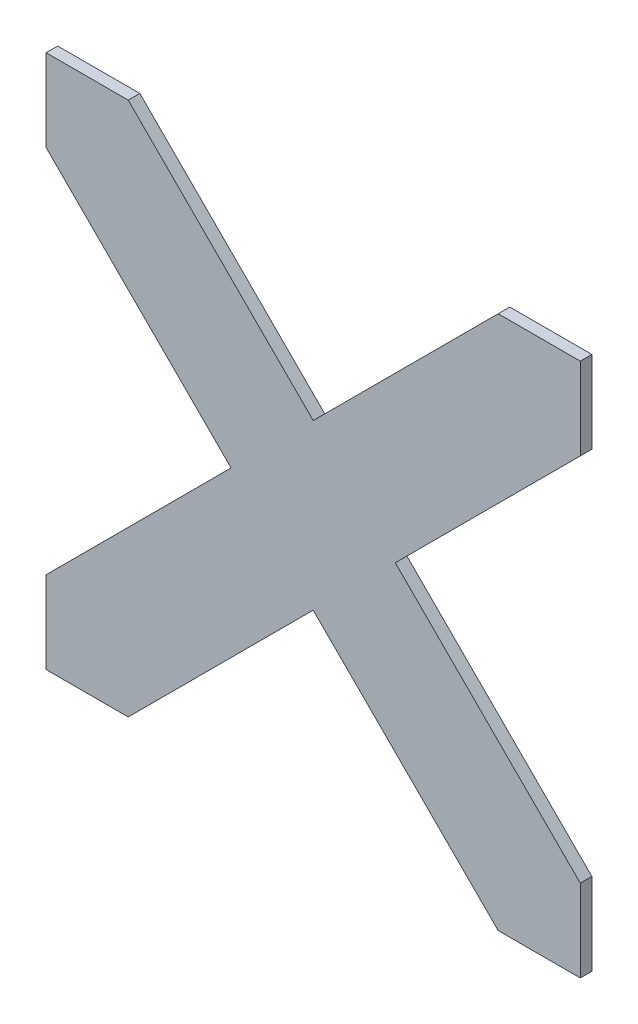
from build123d import *

# Parameters (mm, degrees)
BOSS_EXTRUDE1_DEPTH = 3
BOSS_EXTRUDE2_DEPTH = 3


with BuildPart() as part:
    # Sketch7 → Boss-Extrude1 (new body)
    with BuildSketch(Plane.XY):
        Polygon((-78.549032868, 130.117059275), (38.237763696, 13.33026271), (38.237763696, -7.882940725), (17.02456026, -7.882940725), (-99.762236304, 108.903855839), (-99.762236304, 130.117059275), align=None)
    extrude(amount=BOSS_EXTRUDE1_DEPTH)

    # Sketch8 → Boss-Extrude2 (add)
    with BuildSketch(Plane.XY):
        Polygon((-78.549032868, -7.882940725), (38.237763696, 108.903855839), (38.237763696, 130.117059275), (17.02456026, 130.117059275), (-99.762236304, 13.33026271), (-99.762236304, -7.882940725), align=None)
    extrude(amount=BOSS_EXTRUDE2_DEPTH)


solid = part.part
